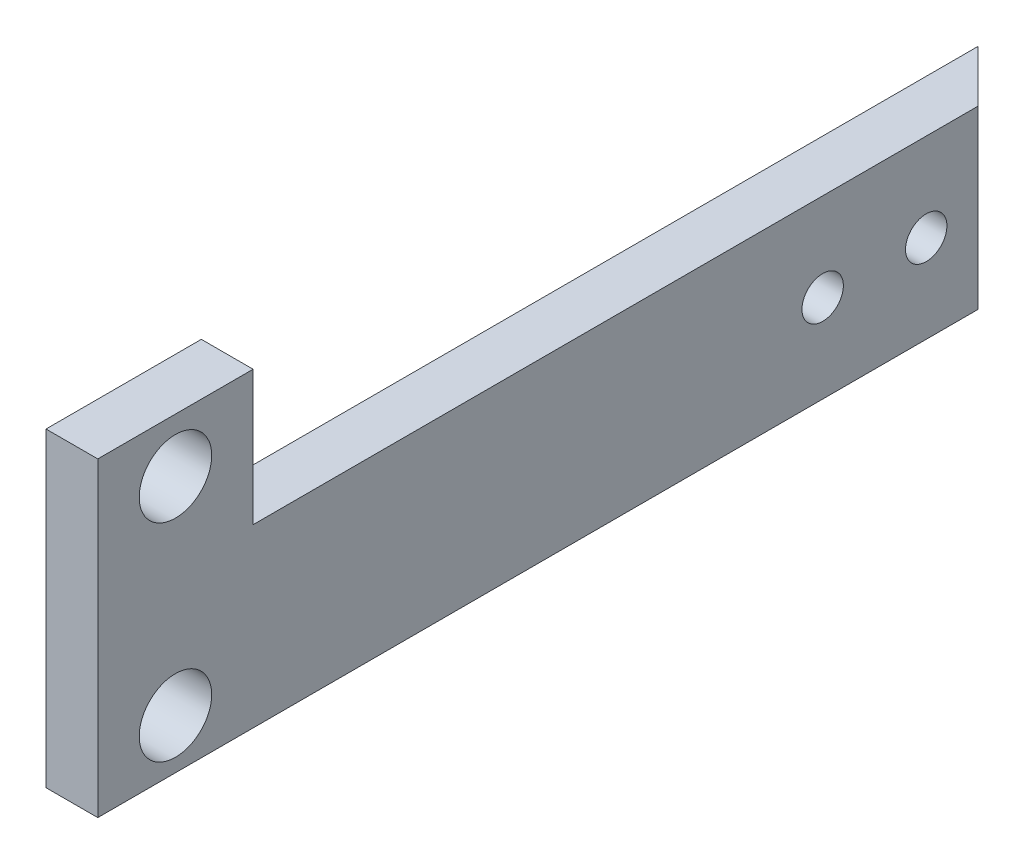
from build123d import *

# Parameters (mm, degrees)
CROQUIS1_W              = 5
CROQUIS1_H              = 30
SALIENTE_EXTRUIR1_DEPTH = 15
CROQUIS2_R              = 3.5
CORTAR_EXTRUIR1_DEPTH   = 15
CROQUIS3_W              = 5
CROQUIS3_H              = 17
SALIENTE_EXTRUIR2_DEPTH = 80
CROQUIS8_R              = 2
CORTAR_EXTRUIR5_DEPTH   = 10
CORTAR_EXTRUIR4_DEPTH   = 30


with BuildPart() as part:
    # Croquis1 → Saliente-Extruir1 (new body)
    with BuildSketch(Plane.XY):
        Rectangle(CROQUIS1_W, CROQUIS1_H)
    extrude(amount=SALIENTE_EXTRUIR1_DEPTH)

    # Croquis2 → Cortar-Extruir1 (cut)
    with BuildSketch(Plane(origin=(2.5, 0, 0), x_dir=(0, 0, -1), z_dir=(1, 0, 0))):
        with Locations((-7.5, 9.795077014)):
            Circle(CROQUIS2_R)
        with Locations((-7.5, -10.204922986)):
            Circle(CROQUIS2_R)
    extrude(amount=-CORTAR_EXTRUIR1_DEPTH, mode=Mode.SUBTRACT)

    # Croquis3 → Saliente-Extruir2 (add)
    with BuildSketch(Plane(origin=(0, 0, 0), x_dir=(-1, 0, 0), z_dir=(0, 0, -1))):
        with Locations((0, -6.5)):
            Rectangle(CROQUIS3_W, CROQUIS3_H)
    extrude(amount=SALIENTE_EXTRUIR2_DEPTH)

    # Croquis8 → Cortar-Extruir5 (cut)
    with BuildSketch(Plane.ZY.offset(2.5)):
        with Locations((-55, -6.5)):
            Circle(CROQUIS8_R)
        with Locations((-65, -6.5)):
            Circle(CROQUIS8_R)
    extrude(amount=-CORTAR_EXTRUIR5_DEPTH, mode=Mode.SUBTRACT)

    # Croquis6 → Cortar-Extruir4 (cut)
    with BuildSketch(Plane(origin=(0, 2, 0), x_dir=(1, 0, 0), z_dir=(0, 1, 0))):
        Polygon((2.5, 70), (2.5, 75), (2.5, 80), (-2.5, 80), (-2.5, 75), align=None)
    extrude(amount=-CORTAR_EXTRUIR4_DEPTH, mode=Mode.SUBTRACT)


solid = part.part
